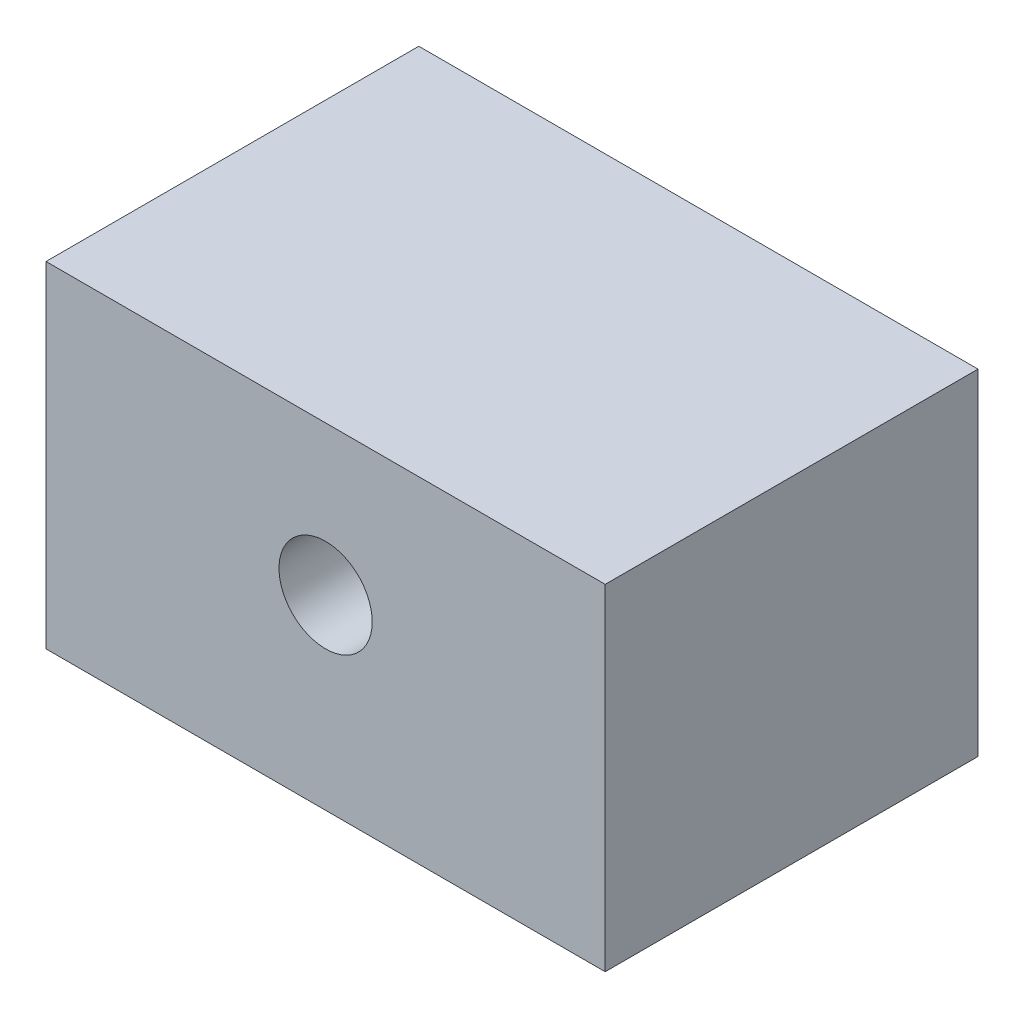
from build123d import *

# Parameters (mm, degrees)
SKETCH1_W           = 30
SKETCH1_H           = 20
BOSS_EXTRUDE1_DEPTH = 18
SKETCH2_R           = 2.5
CUT_EXTRUDE1_DEPTH  = 31.805843601


with BuildPart() as part:
    # Sketch1 → Boss-Extrude1 (new body)
    with BuildSketch(Plane(origin=(0, 0, 0), x_dir=(1, 0, 0), z_dir=(0, 1, 0))):
        Rectangle(SKETCH1_W, SKETCH1_H)
    extrude(amount=BOSS_EXTRUDE1_DEPTH)

    # Sketch2 → Cut-Extrude1 (cut, through all)
    with BuildSketch(Plane.XY.offset(10)):
        with Locations((0, 10)):
            Circle(SKETCH2_R)
    extrude(amount=-CUT_EXTRUDE1_DEPTH, mode=Mode.SUBTRACT)


solid = part.part
